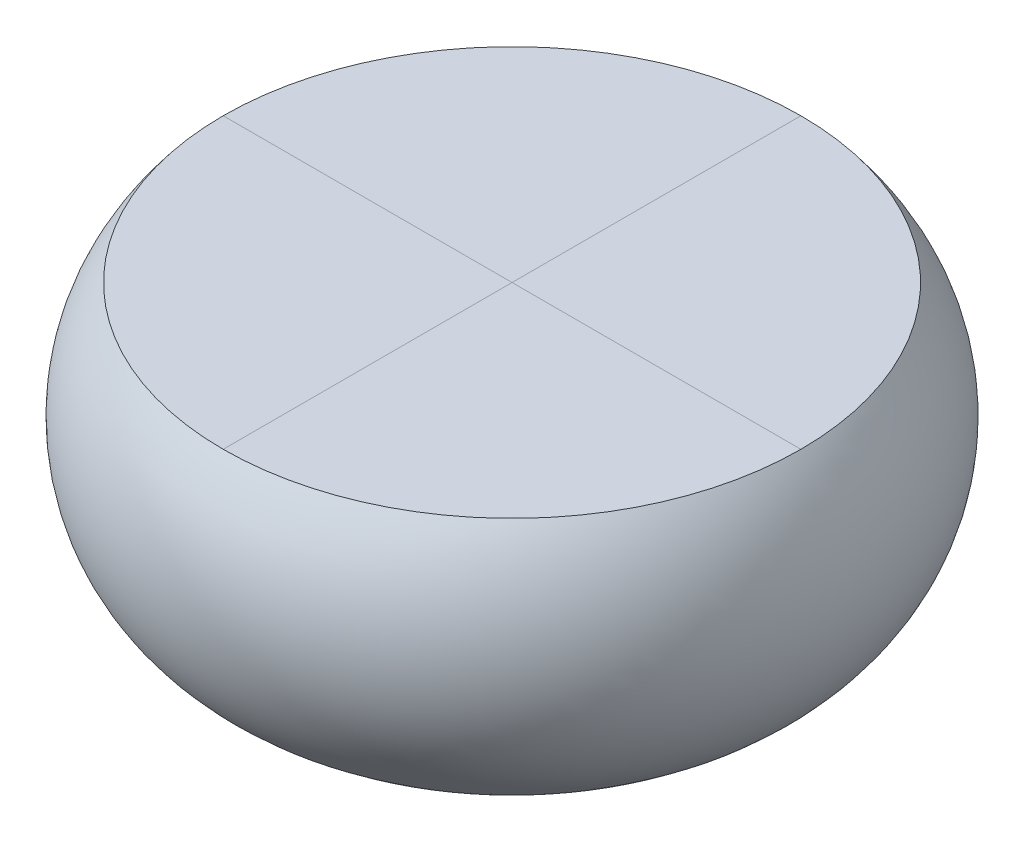
from build123d import *


with BuildPart() as part:
    # Sketch1 → Revolve6 (revolve)
    with BuildSketch(Plane.XY, mode=Mode.PRIVATE) as revolve6_sk:
        with BuildLine():
            Line((0, 0), (70.944125676, 0))
            ThreePointArc((70.944125676, 0), (126.937524082, 46.644672122), (115.350199907, 118.59409895))
            Line((115.350199907, 118.59409895), (0, 118.59409895))
            Line((0, 118.59409895), (0, 0))
        make_face()
    revolve(revolve6_sk.sketch.rotate(Axis((0, 197.005351052, 0), (0, -1, 0)), 90), axis=Axis((0, 197.005351052, 0), (0, -1, 0)))


solid = part.part
